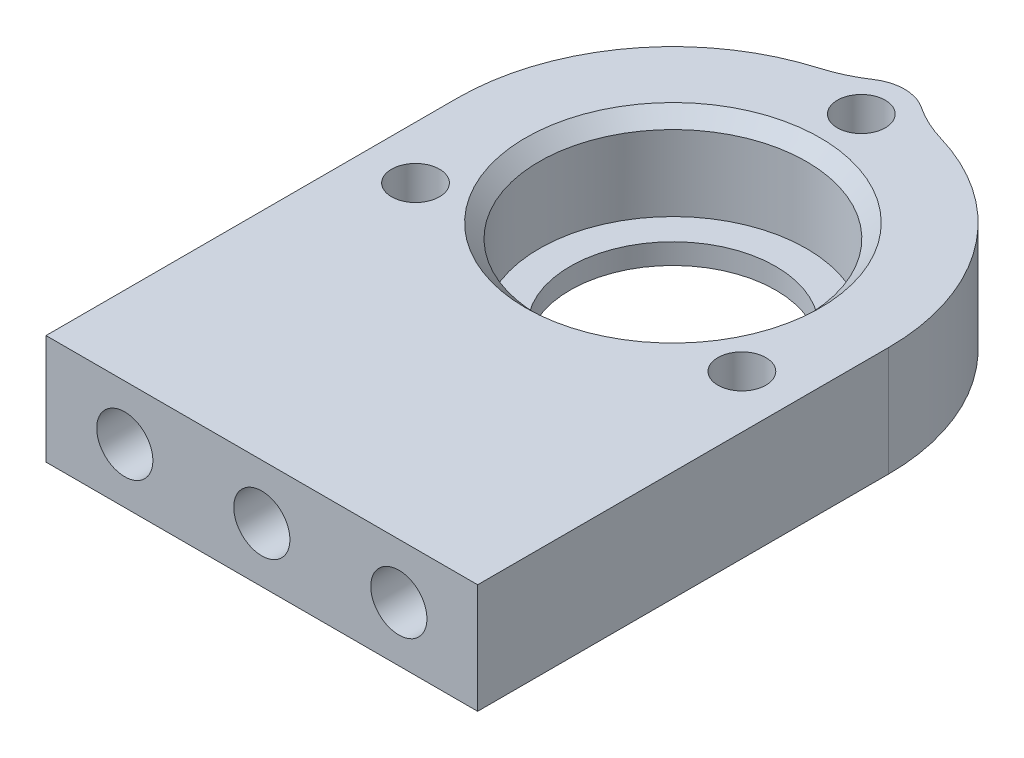
from build123d import *

# Parameters (mm, degrees)
SKETCH_1_R          = 9.75
EXTRUDE_1_DEPTH     = 8
SKETCH_2_R          = 2.05
CUT_EXTRUDE_1_DEPTH = 6
SKETCH_4_R          = 9.75
SKETCH_4_R_2        = 7.5
EXTRUDE_2_DEPTH     = 1.5
EXTRUDE_START       = -8
EXTRUDE_3_DEPTH     = 8
SKETCH_6_R          = 1.75
CUT_EXTRUDE_2_DEPTH = 4
FILLET_1_R          = 10
CHAMFER_1_SIZE      = 1


with BuildPart() as part:
    # Эскиз1 → Бобышка-Вытянуть1 (new body)
    with BuildSketch(Plane(origin=(0, 0, 0), x_dir=(1, 0, 0), z_dir=(0, 1, 0))):
        with BuildLine():
            Line((-15.75, 0), (15.75, 0))
            Line((15.75, 0), (15.75, 30))
            ThreePointArc((15.75, 30), (0, 45.75), (-15.75, 30))
            Line((-15.75, 30), (-15.75, 0))
        make_face()
        with Locations(Location((0, 30, 0), (0, 0, 270))):
            Circle(SKETCH_1_R, mode=Mode.SUBTRACT)
    extrude(amount=EXTRUDE_1_DEPTH)

    # Эскиз2 → Вырез-Вытянуть1 (cut)
    with BuildSketch(Plane.XY):
        with Locations((0, 4)):
            Circle(SKETCH_2_R)
        with Locations((-10, 4)):
            Circle(SKETCH_2_R)
        with Locations(Location((10, 4, 0), (0, 0, 180))):
            Circle(SKETCH_2_R)
    extrude(amount=-CUT_EXTRUDE_1_DEPTH, mode=Mode.SUBTRACT)

    # Эскиз4 → Бобышка-Вытянуть2 (add)
    with BuildSketch(Plane.XZ):
        with Locations(Location((0, -30, 0), (0, 0, 270))):
            Circle(SKETCH_4_R)
        with Locations(Location((0, -30, 0), (0, 0, 270))):
            Circle(SKETCH_4_R_2, mode=Mode.SUBTRACT)
    extrude(amount=-EXTRUDE_2_DEPTH)

    # Эскиз5 → Бобышка-Вытянуть3 (add)
    with BuildSketch(Plane(origin=(0, 8, 0), x_dir=(1, 0, 0), z_dir=(0, 1, 0)).offset(EXTRUDE_START)):
        with BuildLine():
            ThreePointArc((2.595683542, 45.534636364), (0, 46.9), (-2.595683542, 45.534636364))
            ThreePointArc((-2.595683542, 45.534636364), (0, 45.75), (2.595683542, 45.534636364))
        make_face()
    extrude(amount=EXTRUDE_3_DEPTH)

    # Эскиз6 → Вырез-Вытянуть2 (cut)
    with BuildSketch(Plane(origin=(0, 8, 0), x_dir=(1, 0, 0), z_dir=(0, 1, 0))):
        with Locations(Location((0, 43.75, 0), (0, 0, 270))):
            Circle(SKETCH_6_R)
        with Locations(Location((11.907849302, 23.125, 0), (0, 0, 270))):
            Circle(SKETCH_6_R)
        with Locations(Location((-11.907849302, 23.125, 0), (0, 0, 270))):
            Circle(SKETCH_6_R)
    extrude(amount=-CUT_EXTRUDE_2_DEPTH, mode=Mode.SUBTRACT)

    # Скругление1
    fillet_1_edges = [part.edges().sort_by_distance(p)[0] for p in [
        (2.595683542, 4, -45.534636364),
        (-2.595683542, 4, -45.534636364),
    ]]
    fillet(fillet_1_edges, radius=FILLET_1_R)

    # Фаска1
    chamfer_1_edges = [part.edges().sort_by_distance(p)[0] for p in [
        (0, 8, -39.75),
    ]]
    chamfer(chamfer_1_edges, length=CHAMFER_1_SIZE)


solid = part.part
